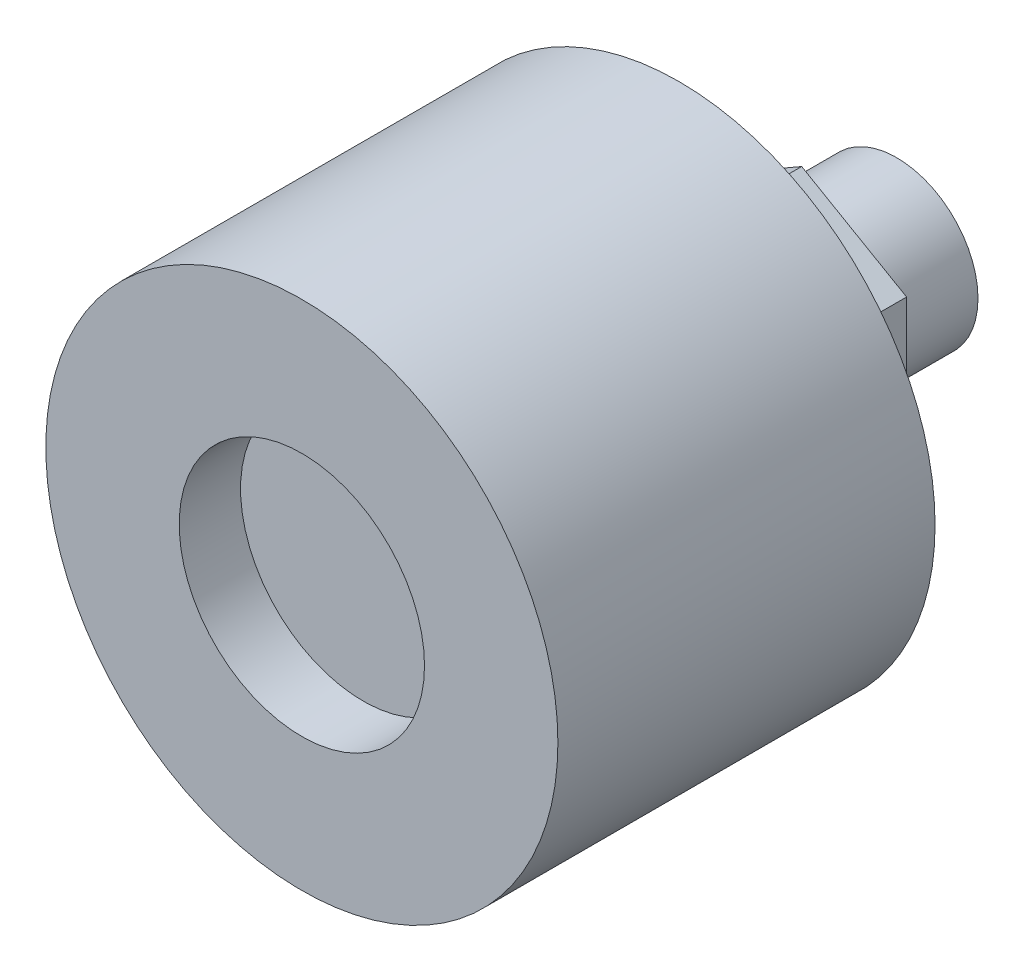
from build123d import *

# Parameters (mm, degrees)
BOSS_EXTRUDE1_DEPTH      = 1
BOSS_EXTRUDE1_DEPTH_BACK = 1
SKETCH3_R                = 8.35
SKETCH3_R_2              = 4
SKETCH4_R                = 8.35
BOSS_EXTRUDE2_DEPTH      = 10.3
BOSS_EXTRUDE4_DEPTH      = 4
SKETCH6_R                = 2.65
BOSS_EXTRUDE5_DEPTH      = 3.1
SKETCH7_R                = 0.244312337
CUT_EXTRUDE1_DEPTH       = 2


with BuildPart() as part:
    # Sketch3 → Boss-Extrude1 (new, two sides: drawn at the far end of the back side and taken through both)
    with BuildSketch(Plane.XY.offset(-BOSS_EXTRUDE1_DEPTH_BACK)):
        Circle(SKETCH3_R)
        Circle(SKETCH3_R_2, mode=Mode.SUBTRACT)
    extrude(amount=BOSS_EXTRUDE1_DEPTH + BOSS_EXTRUDE1_DEPTH_BACK)

    # Sketch4 → Boss-Extrude2 (add)
    with BuildSketch(Plane(origin=(0, 0, -1), x_dir=(-1, 0, 0), z_dir=(0, 0, -1))):
        Circle(SKETCH4_R)
    extrude(amount=BOSS_EXTRUDE2_DEPTH)

    # Sketch5 → Boss-Extrude4 (add)
    with BuildSketch(Plane(origin=(0, 0, -11.3), x_dir=(-1, 0, 0), z_dir=(0, 0, -1))):
        Polygon((0, 3.95), (-3.420800345, 1.975), (-3.420800345, -1.975), (0, -3.95), (3.420800345, -1.975), (3.420800345, 1.975), align=None)
    extrude(amount=BOSS_EXTRUDE4_DEPTH)

    # Sketch6 → Boss-Extrude5 (add)
    with BuildSketch(Plane(origin=(0, 0, -15.3), x_dir=(-1, 0, 0), z_dir=(0, 0, -1))):
        Circle(SKETCH6_R)
    extrude(amount=BOSS_EXTRUDE5_DEPTH)

    # Sketch7 → Cut-Extrude1 (cut)
    with BuildSketch(Plane(origin=(0, 0, -18.4), x_dir=(-1, 0, 0), z_dir=(0, 0, -1))):
        Circle(SKETCH7_R)
    extrude(amount=-CUT_EXTRUDE1_DEPTH, mode=Mode.SUBTRACT)


solid = part.part
